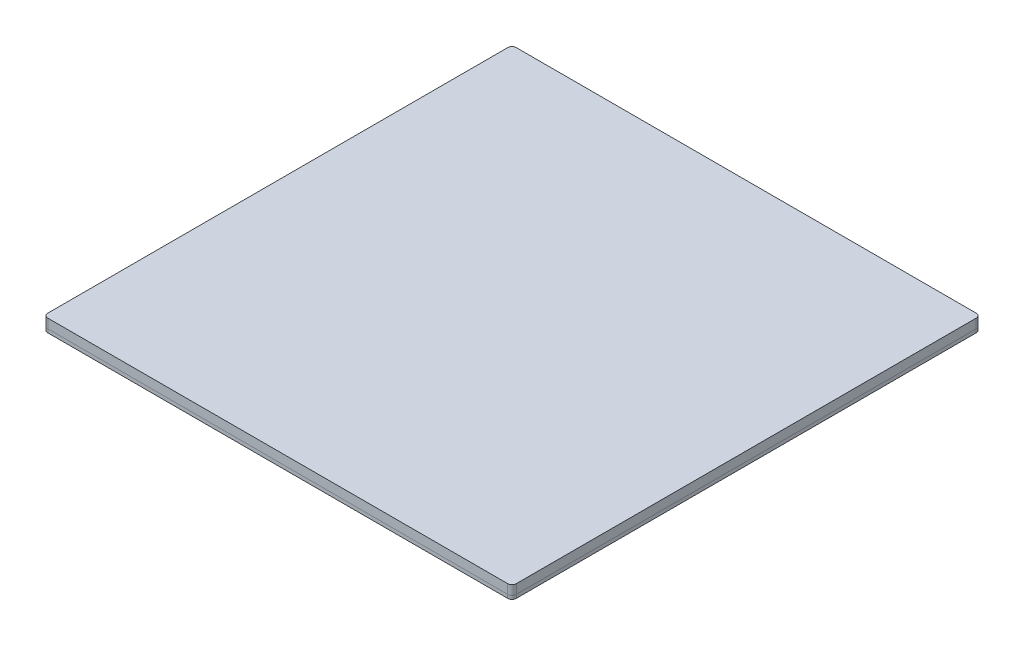
from build123d import *

# Parameters (mm, degrees)
SKETCH1_W           = 220
SKETCH1_H           = 220
BOSS_EXTRUDE1_DEPTH = 4.35
SKETCH2_W           = 220
SKETCH2_H           = 220
BOSS_EXTRUDE2_DEPTH = 1.65
SKETCH4_R           = 1.5
CUT_EXTRUDE1_DEPTH  = 156.624299195
FILLET1_R           = 2
FILLET2_R           = 2


with BuildPart() as part:
    # Sketch1 → Boss-Extrude1 (new body)
    with BuildSketch(Plane(origin=(0, 0, 0), x_dir=(1, 0, 0), z_dir=(0, 1, 0))):
        Rectangle(SKETCH1_W, SKETCH1_H)
    extrude(amount=BOSS_EXTRUDE1_DEPTH)

    # Fillet1
    fillet1_edges = [part.edges().sort_by_distance(p)[0] for p in [
        (110, 2.175, 110),
        (-110, 2.175, 110),
        (-110, 2.175, -110),
        (110, 2.175, -110),
    ]]
    fillet(fillet1_edges, radius=FILLET1_R)


with BuildPart() as body_2:
    # Sketch2 → Boss-Extrude2 (new body)
    with BuildSketch(Plane.XZ):
        Rectangle(SKETCH2_W, SKETCH2_H)
    extrude(amount=BOSS_EXTRUDE2_DEPTH)

    # Sketch4 → Cut-Extrude1 (cut, through all)
    with BuildSketch(Plane(origin=(0, 0, 0), x_dir=(1, 0, 0), z_dir=(0, 1, 0))):
        with Locations(Location((-104.5, 104.5, 0), (0, 0, 270))):
            Circle(SKETCH4_R)
        with Locations(Location((104.5, 104.5, 0), (0, 0, 270))):
            Circle(SKETCH4_R)
        with Locations(Location((104.5, -104.5, 0), (0, 0, 270))):
            Circle(SKETCH4_R)
        with Locations(Location((-104.5, -104.5, 0), (0, 0, 270))):
            Circle(SKETCH4_R)
    extrude(amount=-CUT_EXTRUDE1_DEPTH, mode=Mode.SUBTRACT)

    # Fillet2
    fillet2_edges = [body_2.edges().sort_by_distance(p)[0] for p in [
        (-110, -0.825, -110),
        (-110, -0.825, 110),
        (110, -0.825, 110),
        (110, -0.825, -110),
    ]]
    fillet(fillet2_edges, radius=FILLET2_R)


solid = Compound([part.part, body_2.part])
